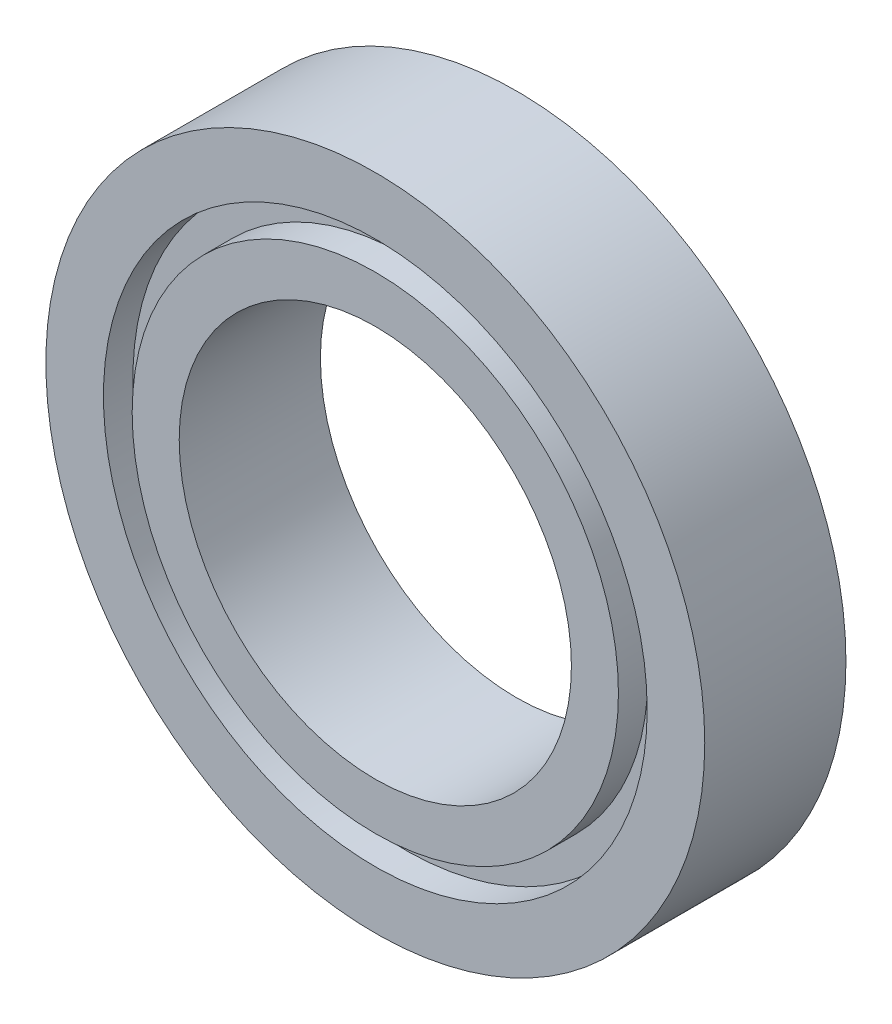
from build123d import *

# Parameters (mm, degrees)
SKETCH_1_R      = 21
SKETCH_1_R_2    = 12.5
EXTRUDE_1_DEPTH = 4.5
SKETCH_5_W      = 1.875649264
SKETCH_5_H      = 1.832016606


with BuildPart() as part:
    # 草图1 → 凸台-拉伸1 (new, symmetric)
    with BuildSketch(Plane.XY):
        Circle(SKETCH_1_R)
        Circle(SKETCH_1_R_2, mode=Mode.SUBTRACT)
    extrude(amount=EXTRUDE_1_DEPTH, both=True)

    # 草图5 → 切除-旋转1 (revolve, cut)
    with BuildSketch(Plane(origin=(0, 0, 0), x_dir=(0, 0, -1), z_dir=(1, 0, 0)), mode=Mode.PRIVATE) as cut_revolve_1_sk:
        with Locations((-3.562175368, 16.414104413)):
            Rectangle(SKETCH_5_W, SKETCH_5_H)
        with Locations((3.562175368, 16.414104413)):
            Rectangle(SKETCH_5_W, SKETCH_5_H)
    revolve(cut_revolve_1_sk.sketch.rotate(Axis((0, 0, 0), (0, 0, -1)), 90), axis=Axis((0, 0, 0), (0, 0, -1)), mode=Mode.SUBTRACT)


solid = part.part
